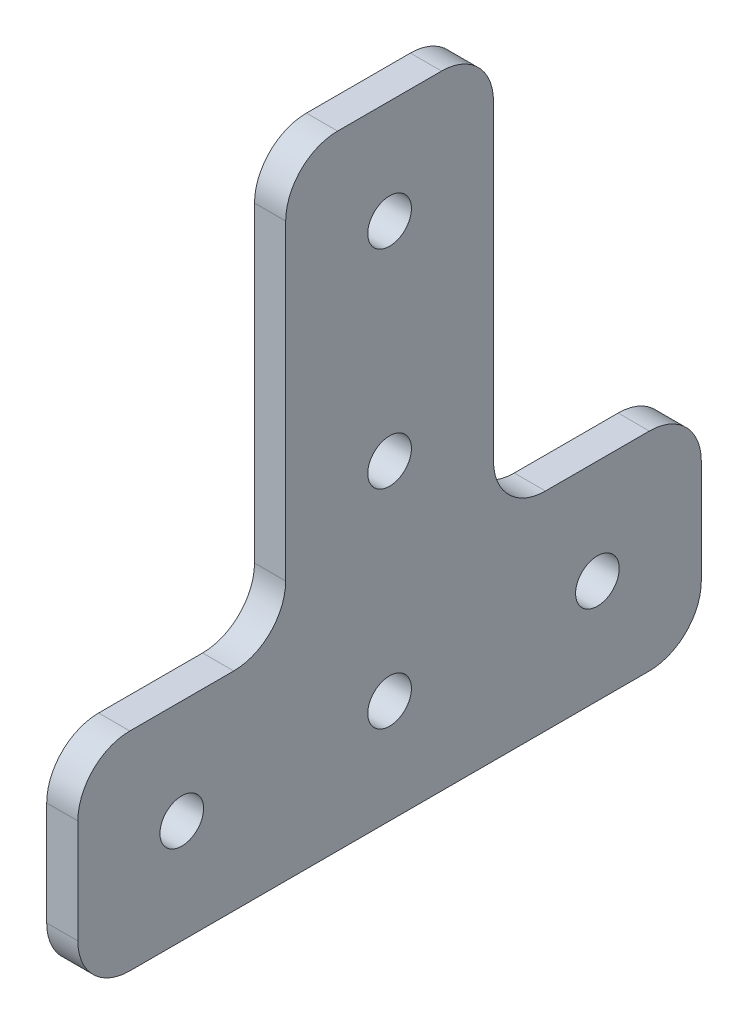
from build123d import *

# Parameters (mm, degrees)
SKETCH_1_R      = 2.1
EXTRUDE_1_DEPTH = 3
FILLET_1_R      = 5


with BuildPart() as part:
    # 草图1 → 凸台-拉伸1 (new body)
    with BuildSketch(Plane(origin=(0, 0, 0), x_dir=(0, 0, -1), z_dir=(1, 0, 0))):
        Polygon((-10, 10), (-10, 50), (10, 50), (10, 10), (30, 10), (30, -10), (-30, -10), (-30, 10), align=None)
        with Locations((-20, 0)):
            Circle(SKETCH_1_R, mode=Mode.SUBTRACT)
        Circle(SKETCH_1_R, mode=Mode.SUBTRACT)
        with Locations((20, 0)):
            Circle(SKETCH_1_R, mode=Mode.SUBTRACT)
        with Locations((0, 20)):
            Circle(SKETCH_1_R, mode=Mode.SUBTRACT)
        with Locations((0, 40)):
            Circle(SKETCH_1_R, mode=Mode.SUBTRACT)
    extrude(amount=EXTRUDE_1_DEPTH)

    # 圆角1
    fillet_1_edges = [part.edges().sort_by_distance(p)[0] for p in [
        (1.5, -10, -30),
        (1.5, -10, 30),
        (1.5, 10, 30),
        (1.5, 10, 10),
        (1.5, 50, 10),
        (1.5, 50, -10),
        (1.5, 10, -10),
        (1.5, 10, -30),
    ]]
    fillet(fillet_1_edges, radius=FILLET_1_R)


solid = part.part
